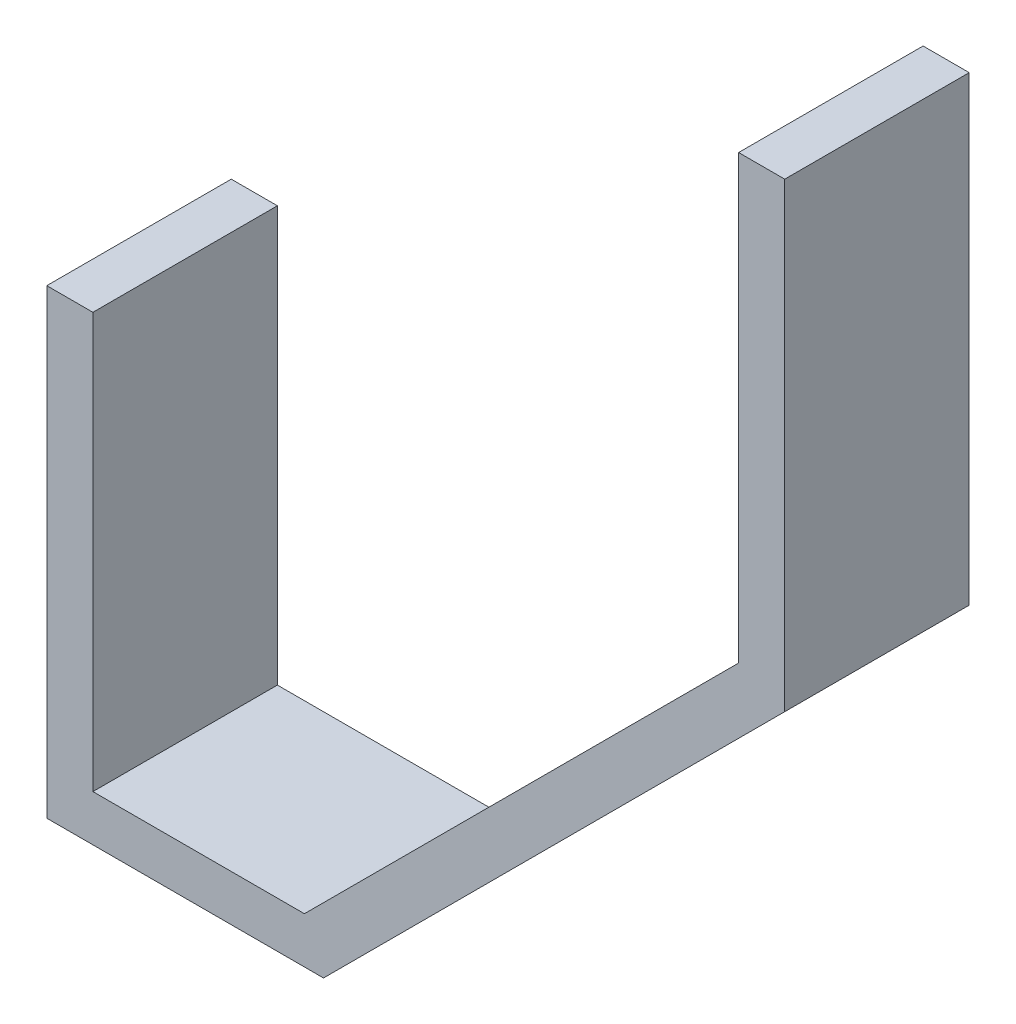
from build123d import *

# Parameters (mm, degrees)
EXTRUDE_1_DEPTH = 20


with BuildPart() as part:
    # Эскиз1 → Бобышка-Вытянуть1 (new body)
    with BuildSketch(Plane.XY):
        Polygon((30, 0), (80, 50), (80, 100), (75, 100), (75, 52.071067812), (27.928932188, 5), (5, 5), (5, 50), (0, 50), (0, 0), align=None)
    extrude(amount=EXTRUDE_1_DEPTH)


solid = part.part
